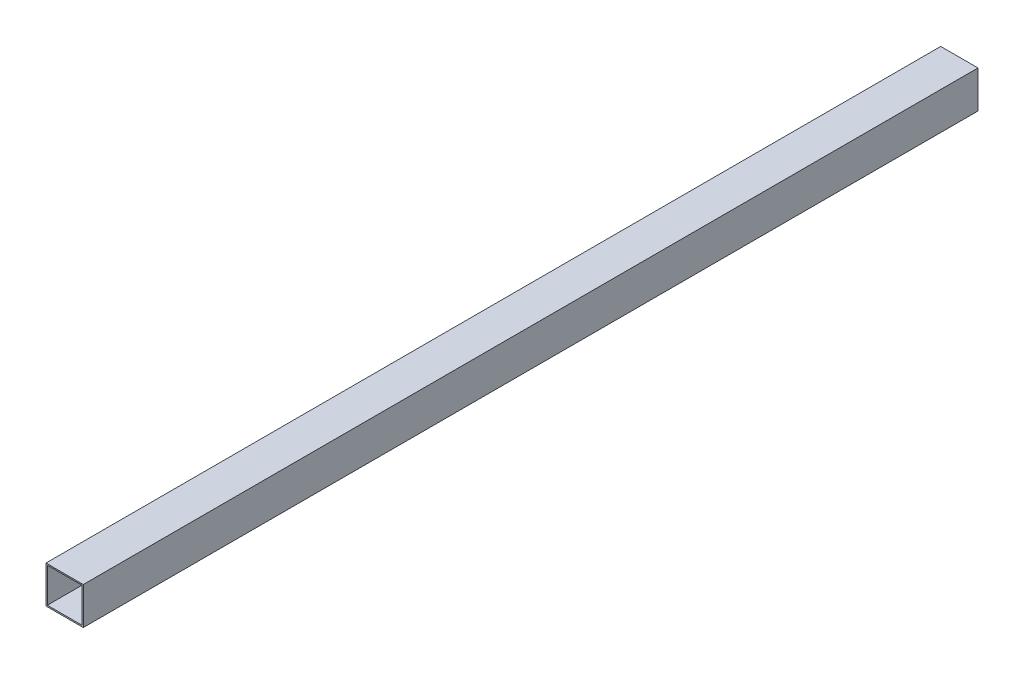
from build123d import *

# Parameters (mm, degrees)
SKETCH_1_W          = 25.4
SKETCH_1_H          = 25.4
EXTRUDE_1_DEPTH     = 609.6
SKETCH_2_W          = 23.530648384
SKETCH_2_H          = 23.589493471
CUT_EXTRUDE_1_DEPTH = 609.6


with BuildPart() as part:
    # 草图1 → 凸台-拉伸1 (new body)
    with BuildSketch(Plane.XY):
        with Locations((-4.087493482, 7.330306081)):
            Rectangle(SKETCH_1_W, SKETCH_1_H)
    extrude(amount=EXTRUDE_1_DEPTH)

    # 草图2 → 切除-拉伸1 (cut)
    with BuildSketch(Plane.XY.offset(609.6)):
        with Locations((-4.109272983, 7.365954195)):
            Rectangle(SKETCH_2_W, SKETCH_2_H)
    extrude(amount=-CUT_EXTRUDE_1_DEPTH, mode=Mode.SUBTRACT)


solid = part.part
